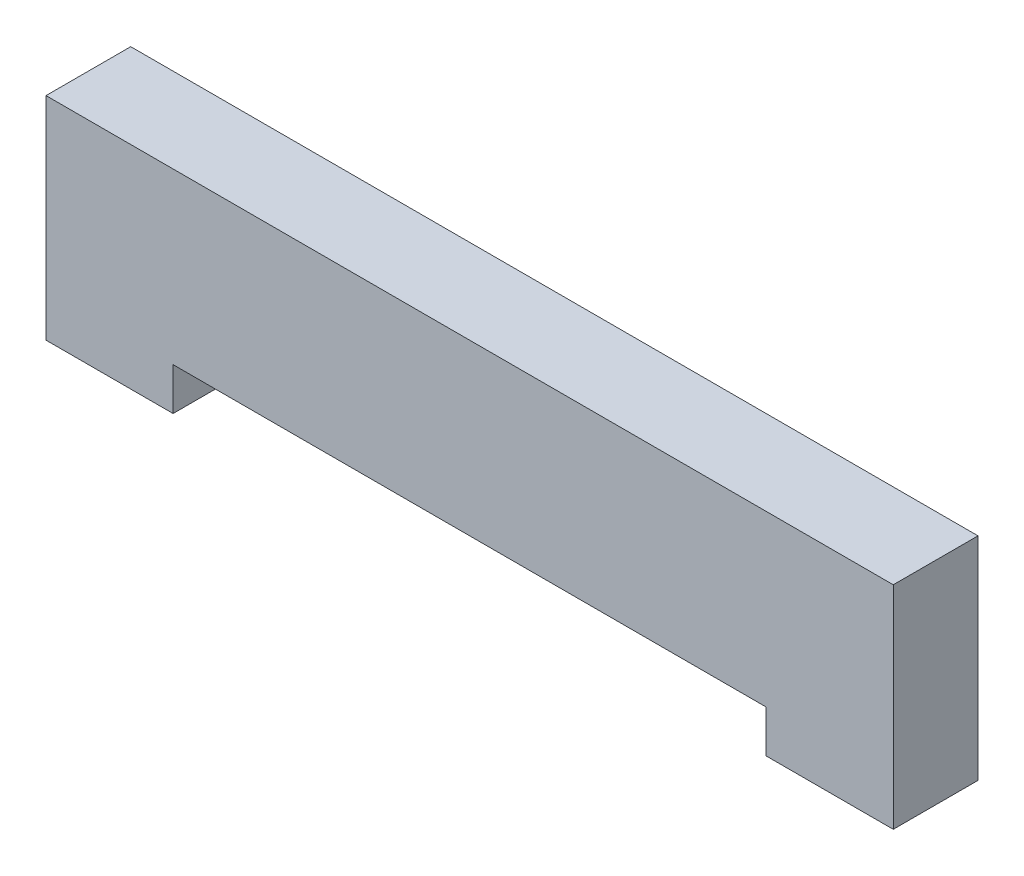
from build123d import *

# Parameters (mm, degrees)
BOSS_EXTRU_1_DEPTH      = 25
ENL_V_MAT_EXTRU_1_REACH = 58.789
ESQUISSE3_R             = 2
ENL_V_MAT_EXTRU_2_DEPTH = 15


with BuildPart() as part:
    # Esquisse1 → Boss.-Extru.1 (new body)
    with BuildSketch(Plane(origin=(0, 0, 0), x_dir=(1, 0, 0), z_dir=(0, 1, 0))):
        Polygon((50, 0), (50, 5), (-50, 5), (-50, -5), (50, -5), align=None)
    extrude(amount=BOSS_EXTRU_1_DEPTH)

    # Esquisse2 → Enlèv. mat.-Extru.1 (cut, up to next)
    with BuildSketch(Plane.XY.offset(5), mode=Mode.PRIVATE) as enl_v_mat_extru_1_sk1:
        Polygon((0, 0), (35, 0), (35, 5), (-35, 5), (-35, 0), align=None)
    enl_v_mat_extru_1_tool1 = extrude(enl_v_mat_extru_1_sk1.sketch, amount=-ENL_V_MAT_EXTRU_1_REACH, mode=Mode.PRIVATE) & part.part
    add(enl_v_mat_extru_1_tool1.solids().sort_by_distance((0, 2.5, 5))[0], mode=Mode.SUBTRACT)

    # Esquisse3 → Enlèv. mat.-Extru.2 (cut)
    with BuildSketch(Plane.XZ):
        with Locations(Location((-42.5, 0, 0), (0, 0, 270))):
            Circle(ESQUISSE3_R)
        with Locations(Location((42.5, 0, 0), (0, 0, 270))):
            Circle(ESQUISSE3_R)
    extrude(amount=-ENL_V_MAT_EXTRU_2_DEPTH, mode=Mode.SUBTRACT)


solid = part.part
